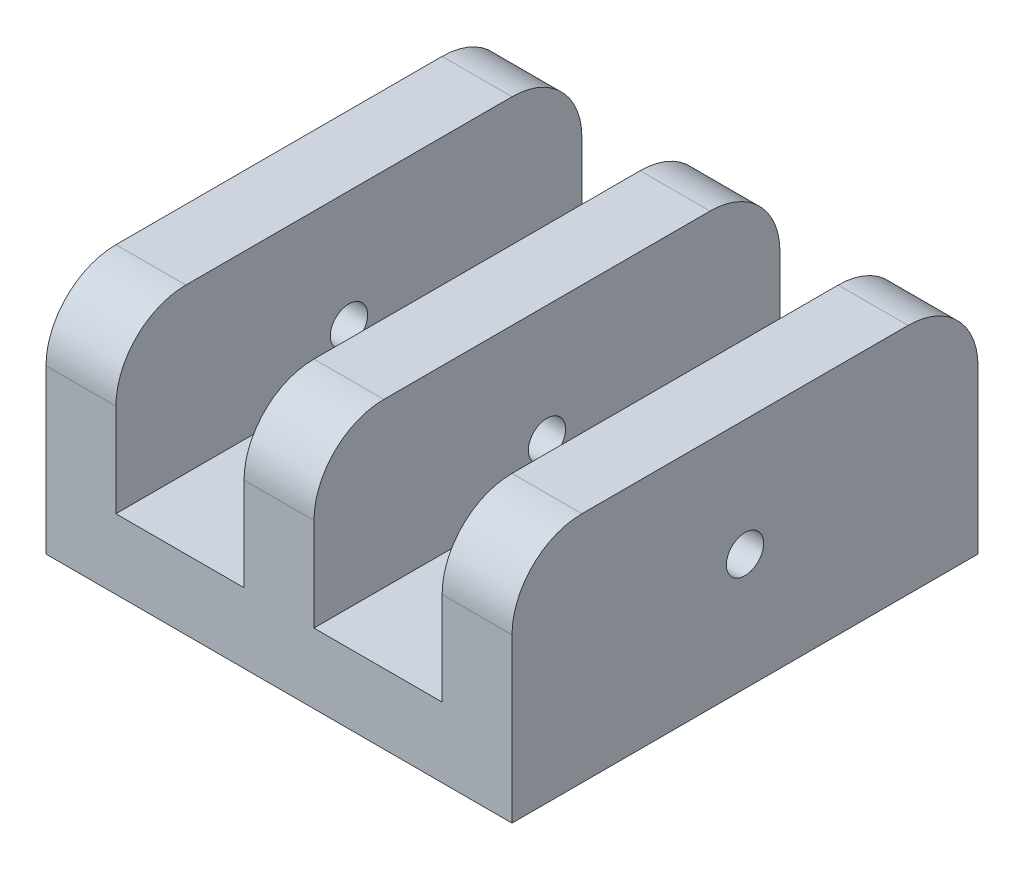
from build123d import *

# Parameters (mm, degrees)
BOSS_EXTRUDE1_DEPTH = 50.8
FILLET3_R           = 7.62
FILLET4_R           = 7.62
SKETCH3_R           = 0.5334
CUT_EXTRUDE1_DEPTH  = 75.009515604
SKETCH4_R           = 2.032
CUT_EXTRUDE2_DEPTH  = 77.2


with BuildPart() as part:
    # 3DSketch1 → Boss-Extrude1 (new body)
    with BuildSketch(Plane(origin=(0, 25.4, 0), x_dir=(0.894427190999916, -0.447213595499958, 0), z_dir=(0, 0, -1))):
        Polygon((0, 0), (11.359225326, 22.718450651), (56.796126628, 0), (45.436901303, -22.718450651), (38.621366107, -19.310683054), (46.572823835, -3.407767598), (34.077675977, 2.839806331), (26.126218249, -13.063109125), (19.310683054, -9.655341527), (27.262140782, 6.247573929), (14.766992923, 12.495147858), (6.815535195, -3.407767598), align=None)
    extrude(amount=-BOSS_EXTRUDE1_DEPTH)

    # Fillet3
    fillet3_edges = [part.edges().sort_by_distance(p)[0] for p in [
        (3.81, 25.4, 50.8),
        (25.4, 25.4, 50.8),
        (46.99, 25.4, 50.8),
    ]]
    fillet(fillet3_edges, radius=FILLET3_R)

    # Fillet4
    fillet4_edges = [part.edges().sort_by_distance(p)[0] for p in [
        (46.99, 25.4, 0),
        (25.4, 25.4, 0),
        (3.81, 25.4, 0),
    ]]
    fillet(fillet4_edges, radius=FILLET4_R)

    # Sketch3 → Cut-Extrude1 (cut, through all)
    with BuildSketch(Plane(origin=(0, 7.62, 0), x_dir=(1, 0, 0), z_dir=(0, 1, 0))):
        with Locations(Location((14.605, -25.4, 0), (0, 0, 180))):
            Circle(SKETCH3_R)
        with Locations(Location((36.195, -25.4, 0), (0, 0, 180))):
            Circle(SKETCH3_R)
    extrude(amount=-CUT_EXTRUDE1_DEPTH, mode=Mode.SUBTRACT)

    # Sketch4 → Cut-Extrude2 (cut, through all)
    with BuildSketch(Plane(origin=(50.8, 0, 0), x_dir=(0, 0, -1), z_dir=(1, 0, 0))):
        with Locations(Location((-25.4, 12.7, 0), (0, 0, 90))):
            Circle(SKETCH4_R)
    extrude(amount=-CUT_EXTRUDE2_DEPTH, mode=Mode.SUBTRACT)


solid = part.part
